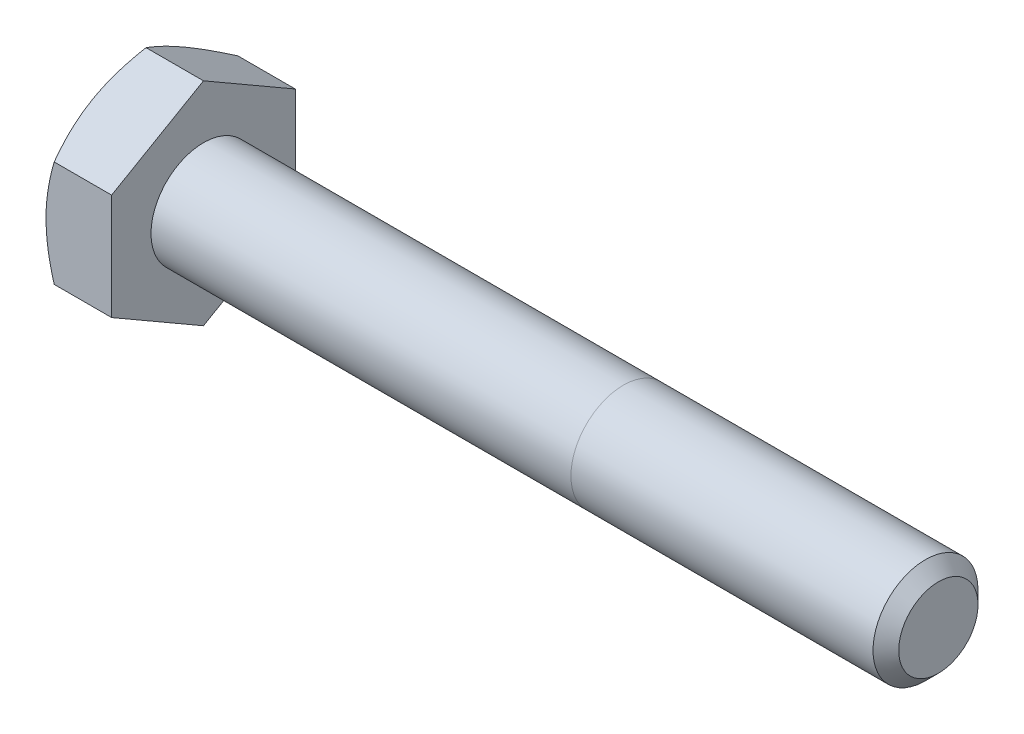
from build123d import *

# Parameters (mm, degrees)
SKETCH5_R           = 3.175
BOSS_EXTRUDE3_DEPTH = 44.45
CHAMFER1_SIZE       = 0.77724
BOSS_EXTRUDE4_DEPTH = 3.96875
SKETCH8_OUTSIDE_W   = 197.122
SKETCH8_OUTSIDE_H   = 198.842
SKETCH8_OUTSIDE_R   = 5.55625
CUT_EXTRUDE3_DEPTH  = 50.156991545
CUT_EXTRUDE3_DRAFT  = -60
CUT_EXTRUDE4_DEPTH  = 0.254
CIRPATTERN1_COUNT   = 3


with BuildPart() as part:
    # Sketch5 → Boss-Extrude3 (new body)
    with BuildSketch(Plane(origin=(24.209375, 0, 0), x_dir=(0, 0, -1), z_dir=(1, 0, 0))):
        Circle(SKETCH5_R)
    extrude(amount=-BOSS_EXTRUDE3_DEPTH)

    # Chamfer1
    chamfer1_edges = [part.edges().sort_by_distance(p)[0] for p in [
        (24.209375, 0, 3.175),
    ]]
    chamfer(chamfer1_edges, length=CHAMFER1_SIZE)

    # Sketch6 → Boss-Extrude4 (add)
    with BuildSketch(Plane.ZY.offset(20.240625)):
        Polygon((5.55625, 3.207902433), (0, 6.415804866), (-5.55625, 3.207902433), (-5.55625, -3.207902433), (0, -6.415804866), (5.55625, -3.207902433), align=None)
    extrude(amount=BOSS_EXTRUDE4_DEPTH)


with BuildPart() as cut_extrude3_tool:
    # Sketch8 outside → Cut-Extrude3 (with draft: the straight prism first)
    with BuildSketch(Plane.ZY.offset(24.209375)):
        Rectangle(SKETCH8_OUTSIDE_W, SKETCH8_OUTSIDE_H)
        Circle(SKETCH8_OUTSIDE_R, mode=Mode.SUBTRACT)
    extrude(amount=-CUT_EXTRUDE3_DEPTH)
    # Cut-Extrude3: the draft: its side faces are tilted about the plane it starts from
    cut_extrude3_sides = [cut_extrude3_tool.faces().sort_by_distance(p)[0] for p in [
        (0.869120772, -99.421, 0),
        (0.869120772, 0, 98.561),
        (0.869120772, 99.421, 0),
        (0.869120772, 0, -98.561),
        (0.869120772, 0, -5.55625),
    ]]
    draft(cut_extrude3_sides, Plane.ZY.offset(24.209375), CUT_EXTRUDE3_DRAFT)


with BuildPart() as part_1:
    add(part.part)

    # Cut-Extrude3: cut by cut_extrude3_tool
    add(cut_extrude3_tool.part, mode=Mode.SUBTRACT)

    # Sketch12 → Cut-Extrude4 (cut)
    with BuildSketch(Plane.ZY.offset(24.209375)):
        with BuildLine():
            Line((0.1666875, 4.2783125), (0.1666875, 2.3891875))
            ThreePointArc((0.1666875, 2.3891875), (0, 2.2225), (-0.1666875, 2.3891875))
            Line((-0.1666875, 2.3891875), (-0.1666875, 4.2783125))
            ThreePointArc((-0.1666875, 4.2783125), (0, 4.445), (0.1666875, 4.2783125))
        make_face()
    cut_extrude4 = extrude(amount=-CUT_EXTRUDE4_DEPTH, mode=Mode.SUBTRACT)

    # CirPattern1: Cut-Extrude4 ×3 about axis
    cirpattern1_axis = Axis((0, 0, 0), (1, 0, 0))
    for i in range(1, CIRPATTERN1_COUNT):
        add(cut_extrude4.rotate(cirpattern1_axis, i * 360 / CIRPATTERN1_COUNT), mode=Mode.SUBTRACT)


solid = part_1.part
